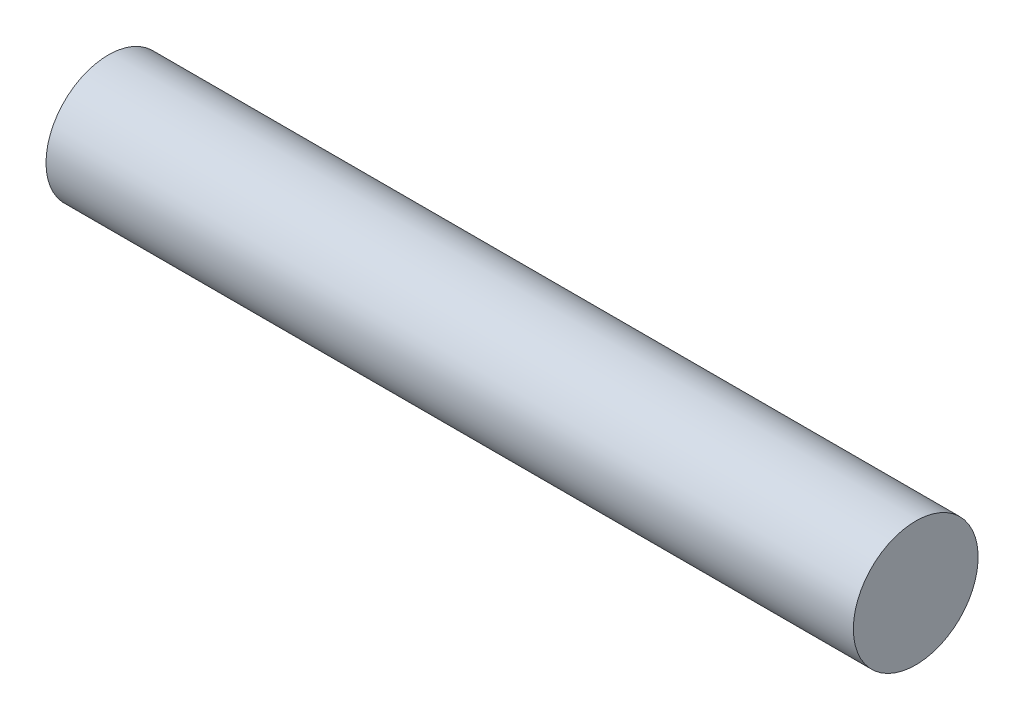
from build123d import *

# Parameters (mm, degrees)
SKETCH1_W = 25.4762
SKETCH1_H = 1.9685


with BuildPart() as part:
    # Sketch1 → Revolve1 (revolve)
    with BuildSketch(Plane.XY):
        with Locations((12.7381, 0.98425)):
            Rectangle(SKETCH1_W, SKETCH1_H)
    revolve(axis=Axis((-5.827802382, 0, 0), (1, 0, 0)))


solid = part.part
